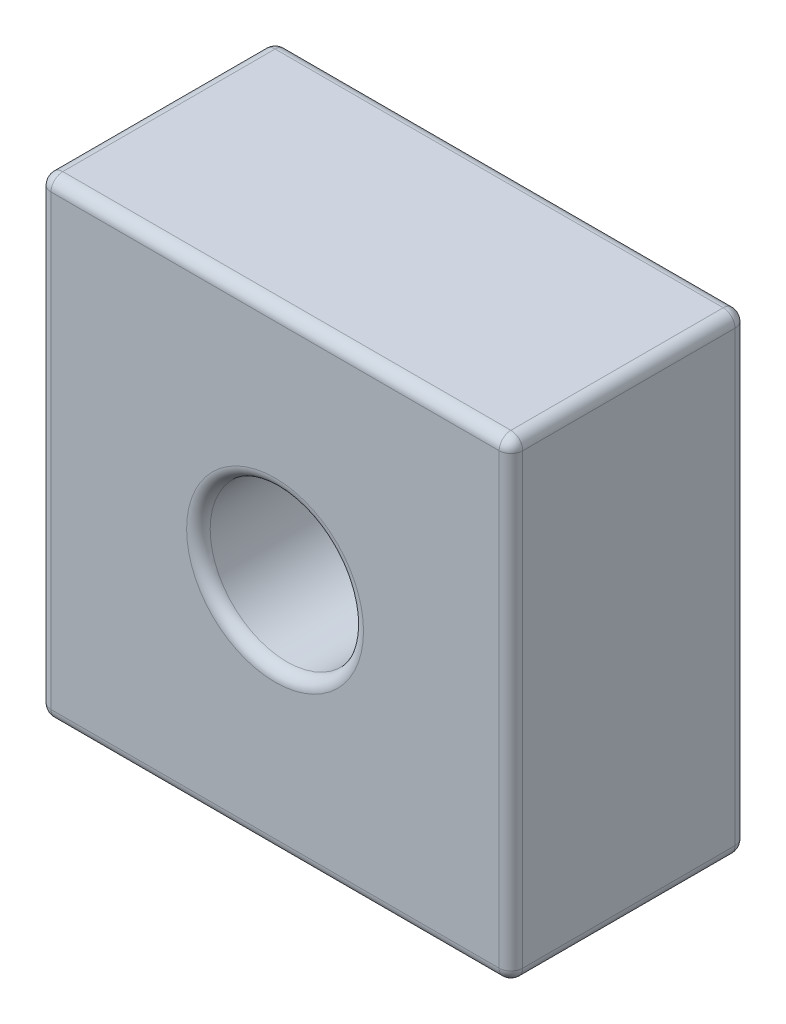
from build123d import *

# Parameters (mm, degrees)
ESQUISSE1_W        = 20
ESQUISSE1_H        = 20
ESQUISSE1_R        = 3.25
BOSS_EXTRU_1_DEPTH = 10
CONG_1_R           = 0.5


with BuildPart() as part:
    # Esquisse1 → Boss.-Extru.1 (new body)
    with BuildSketch(Plane.XY):
        Rectangle(ESQUISSE1_W, ESQUISSE1_H)
        Circle(ESQUISSE1_R, mode=Mode.SUBTRACT)
    extrude(amount=BOSS_EXTRU_1_DEPTH)

    # Congé1
    cong_1_edges = [part.edges().sort_by_distance(p)[0] for p in [
        (-3.25, 0, 0),
        (-3.25, 0, 10),
        (10, 0, 10),
        (0, 10, 10),
        (-10, 0, 10),
        (0, 10, 0),
        (10, 0, 0),
        (0, -10, 0),
        (-10, 0, 0),
        (-10, 10, 5),
        (10, 10, 5),
        (10, -10, 5),
        (-10, -10, 5),
        (0, -10, 10),
    ]]
    fillet(cong_1_edges, radius=CONG_1_R)


solid = part.part
